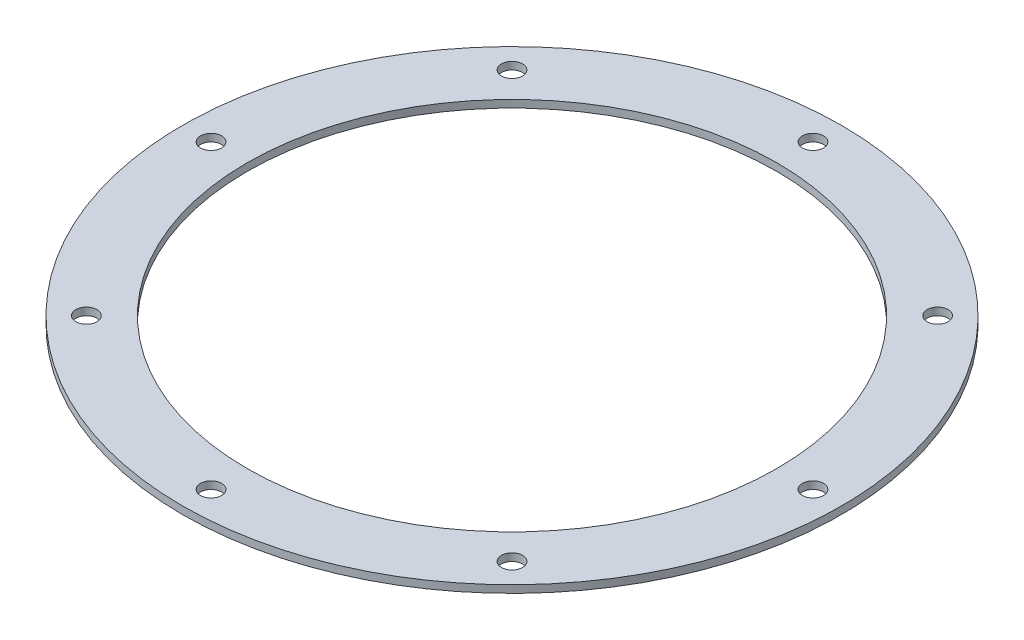
from build123d import *

# Parameters (mm, degrees)
SCHIZZO1_R                   = 219
SCHIZZO1_R_2                 = 176
SCHIZZO1_R_3                 = 7
ESTRUSIONE_ESTRUSIONE1_DEPTH = 2.5


with BuildPart() as part:
    # Schizzo1 → Estrusione-Estrusione1 (new, symmetric)
    with BuildSketch(Plane(origin=(0, 0, 0), x_dir=(1, 0, 0), z_dir=(0, 1, 0))):
        with Locations(Location((0, 0, 0), (0, 0, 270))):
            Circle(SCHIZZO1_R)
        with Locations(Location((0, 0, 0), (0, 0, 270))):
            Circle(SCHIZZO1_R_2, mode=Mode.SUBTRACT)
        with Locations(Location((0, 200, 0), (0, 0, 270))):
            Circle(SCHIZZO1_R_3, mode=Mode.SUBTRACT)
        with Locations(Location((141.421356237, 141.421356237, 0), (0, 0, 270))):
            Circle(SCHIZZO1_R_3, mode=Mode.SUBTRACT)
        with Locations(Location((200, 0, 0), (0, 0, 270))):
            Circle(SCHIZZO1_R_3, mode=Mode.SUBTRACT)
        with Locations(Location((141.421356237, -141.421356237, 0), (0, 0, 270))):
            Circle(SCHIZZO1_R_3, mode=Mode.SUBTRACT)
        with Locations(Location((0, -200, 0), (0, 0, 270))):
            Circle(SCHIZZO1_R_3, mode=Mode.SUBTRACT)
        with Locations(Location((-141.421356237, -141.421356237, 0), (0, 0, 270))):
            Circle(SCHIZZO1_R_3, mode=Mode.SUBTRACT)
        with Locations(Location((-200, 0, 0), (0, 0, 270))):
            Circle(SCHIZZO1_R_3, mode=Mode.SUBTRACT)
        with Locations(Location((-141.421356237, 141.421356237, 0), (0, 0, 270))):
            Circle(SCHIZZO1_R_3, mode=Mode.SUBTRACT)
    extrude(amount=ESTRUSIONE_ESTRUSIONE1_DEPTH, both=True)


solid = part.part
